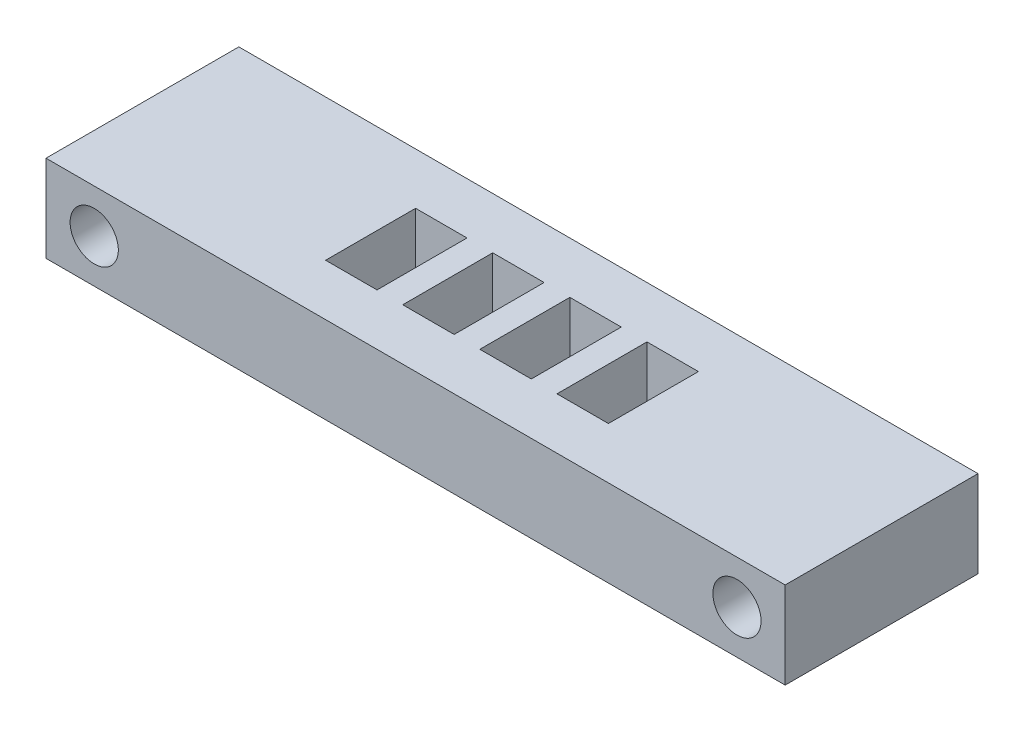
from build123d import *

# Parameters (mm, degrees)
SKETCH1_W           = 57.5
SKETCH1_H           = 15
SKETCH1_W_2         = 4
SKETCH1_H_2         = 7
BOSS_EXTRUDE1_DEPTH = 6.75
SKETCH2_R           = 1.875
CUT_EXTRUDE1_DEPTH  = 60.806458681


with BuildPart() as part:
    # Sketch1 → Boss-Extrude1 (new body)
    with BuildSketch(Plane(origin=(0, 0, 0), x_dir=(1, 0, 0), z_dir=(0, 1, 0))):
        with Locations((28.75, 7.5)):
            Rectangle(SKETCH1_W, SKETCH1_H)
        with Locations((19.75, 7.5)):
            Rectangle(SKETCH1_W_2, SKETCH1_H_2, mode=Mode.SUBTRACT)
        with Locations((25.75, 7.5)):
            Rectangle(SKETCH1_W_2, SKETCH1_H_2, mode=Mode.SUBTRACT)
        with Locations((31.75, 7.5)):
            Rectangle(SKETCH1_W_2, SKETCH1_H_2, mode=Mode.SUBTRACT)
        with Locations((37.75, 7.5)):
            Rectangle(SKETCH1_W_2, SKETCH1_H_2, mode=Mode.SUBTRACT)
    extrude(amount=BOSS_EXTRUDE1_DEPTH)

    # Sketch2 → Cut-Extrude1 (cut, through all)
    with BuildSketch(Plane(origin=(0, 0, -15), x_dir=(-1, 0, 0), z_dir=(0, 0, -1))):
        with Locations((-53.75, 3.375)):
            Circle(SKETCH2_R)
        with Locations((-3.75, 3.375)):
            Circle(SKETCH2_R)
    extrude(amount=-CUT_EXTRUDE1_DEPTH, mode=Mode.SUBTRACT)


solid = part.part
